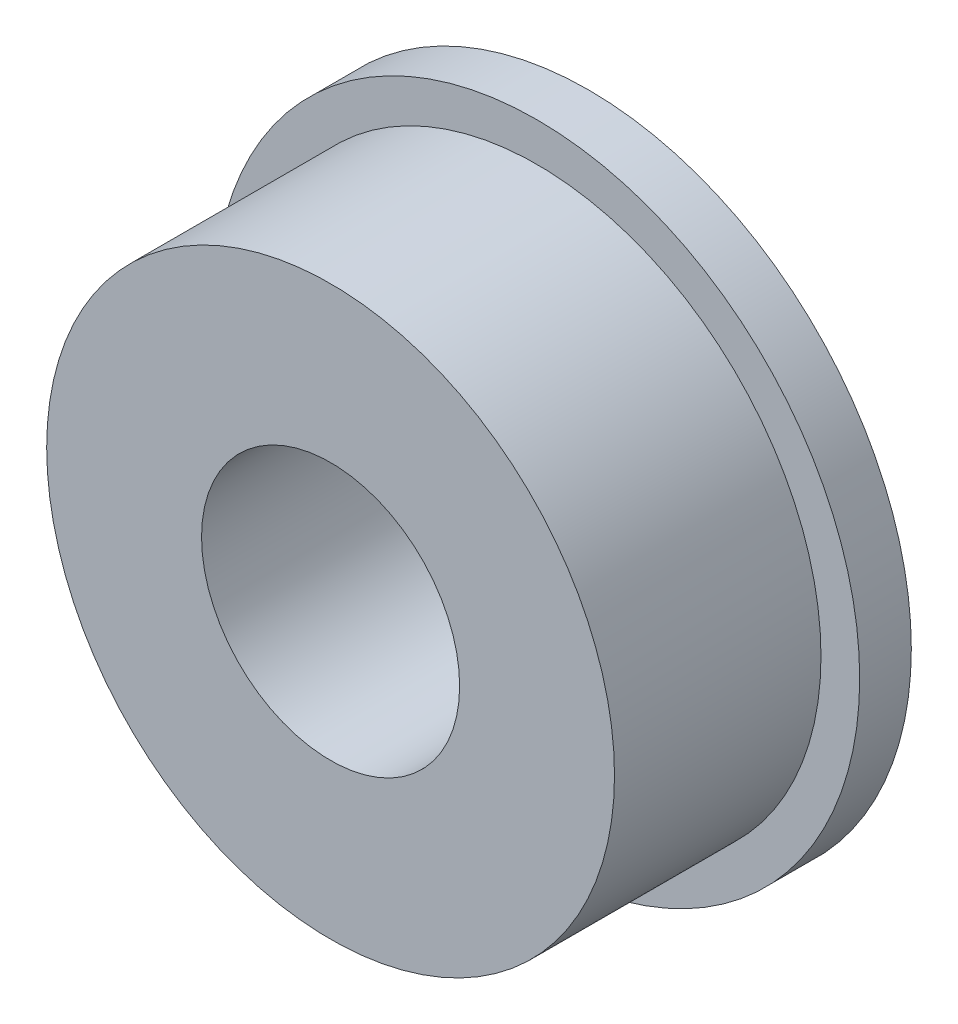
from build123d import *

# Parameters (mm, degrees)
SKETCH_1_R          = 6.25
EXTRUDE_1_DEPTH     = 1
SKETCH_2_R          = 5.5
EXTRUDE_2_DEPTH     = 4
SKETCH_3_R          = 2.5
CUT_EXTRUDE_1_DEPTH = 5


with BuildPart() as part:
    # 草图1 → 凸台-拉伸1 (new body)
    with BuildSketch(Plane.XY):
        Circle(SKETCH_1_R)
    extrude(amount=EXTRUDE_1_DEPTH)

    # 草图2 → 凸台-拉伸2 (add)
    with BuildSketch(Plane.XY.offset(1)):
        Circle(SKETCH_2_R)
    extrude(amount=EXTRUDE_2_DEPTH)

    # 草图3 → 切除-拉伸1 (cut)
    with BuildSketch(Plane.XY.offset(5)):
        Circle(SKETCH_3_R)
    extrude(amount=-CUT_EXTRUDE_1_DEPTH, mode=Mode.SUBTRACT)


solid = part.part
